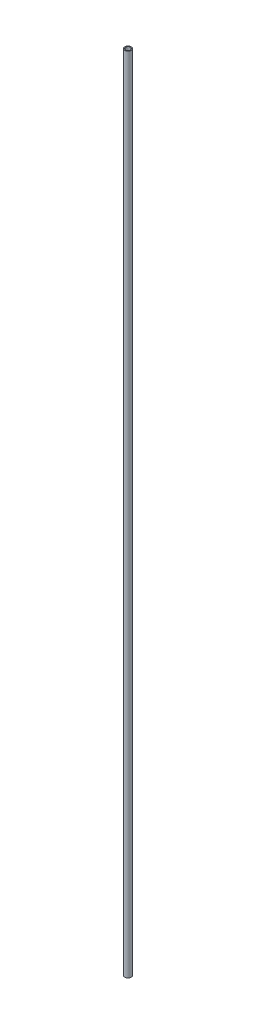
from build123d import *

# Parameters (mm, degrees)
SKETCH2_R   = 4
SKETCH2_R_2 = 3


with BuildPart() as part:
    # Sweep1: sweep along a path in Sketch1
    with BuildLine(Plane.XY) as sweep1_path:
        Line((0, 0), (0, 1000))
    # Sketch2 → Sweep1 (sweep)
    with BuildSketch(Plane(origin=(0, 0, 0), x_dir=(1, 0, 0), z_dir=(0, 1, 0))):
        Circle(SKETCH2_R)
        Circle(SKETCH2_R_2, mode=Mode.SUBTRACT)
    sweep(path=sweep1_path.line)


solid = part.part
